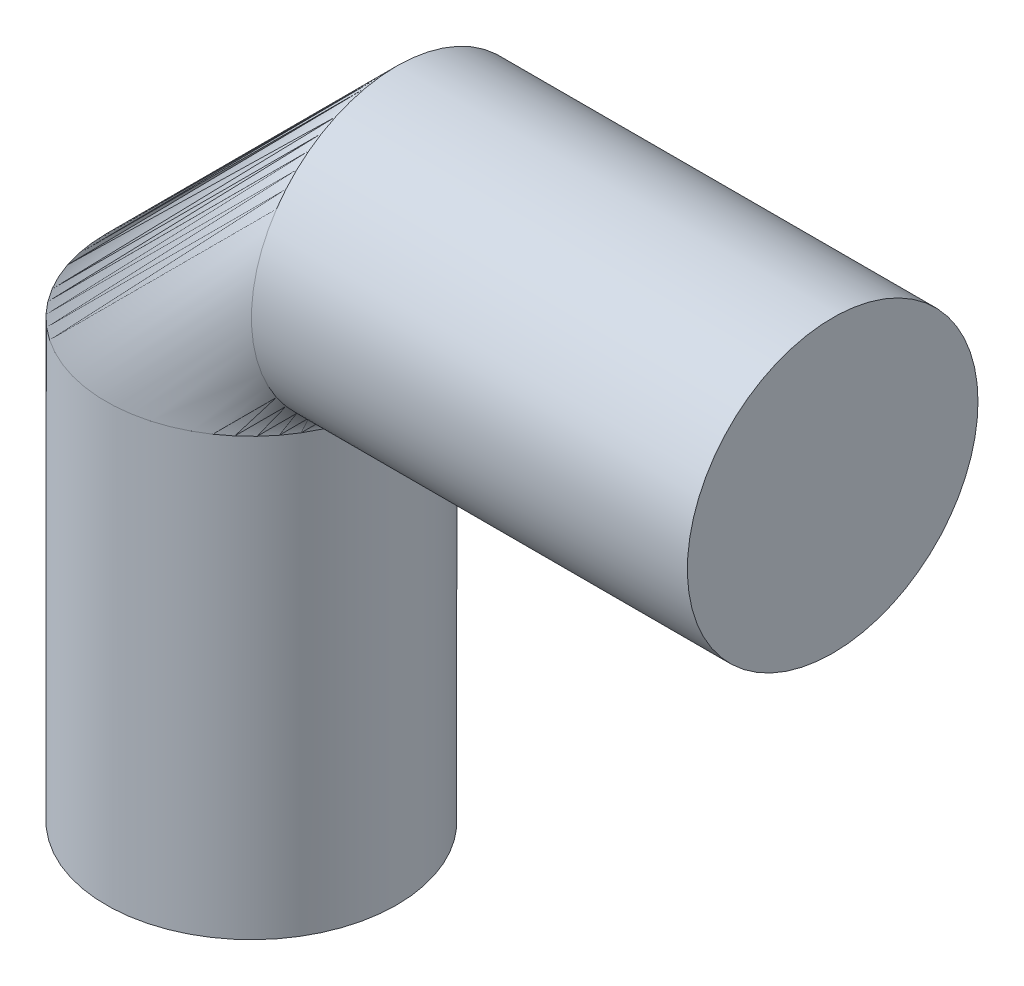
from build123d import *

# Parameters (mm, degrees)
SKETCH2_R = 3.175


with BuildPart() as part:
    # Sweep1: sweep along a path in Sketch1
    with BuildLine(Plane.XY) as sweep1_path:
        Line((12.7, 0), (3.175, 0))
        ThreePointArc((3.175, 0), (0.92993597, -0.92993597), (0, -3.175))
        Line((0, -3.175), (0, -12.7))
    # Sketch2 → Sweep1 (sweep)
    with BuildSketch(Plane(origin=(12.7, 0, 0), x_dir=(0, 0, -1), z_dir=(1, 0, 0))):
        Circle(SKETCH2_R)
    sweep(path=sweep1_path.line)


solid = part.part
